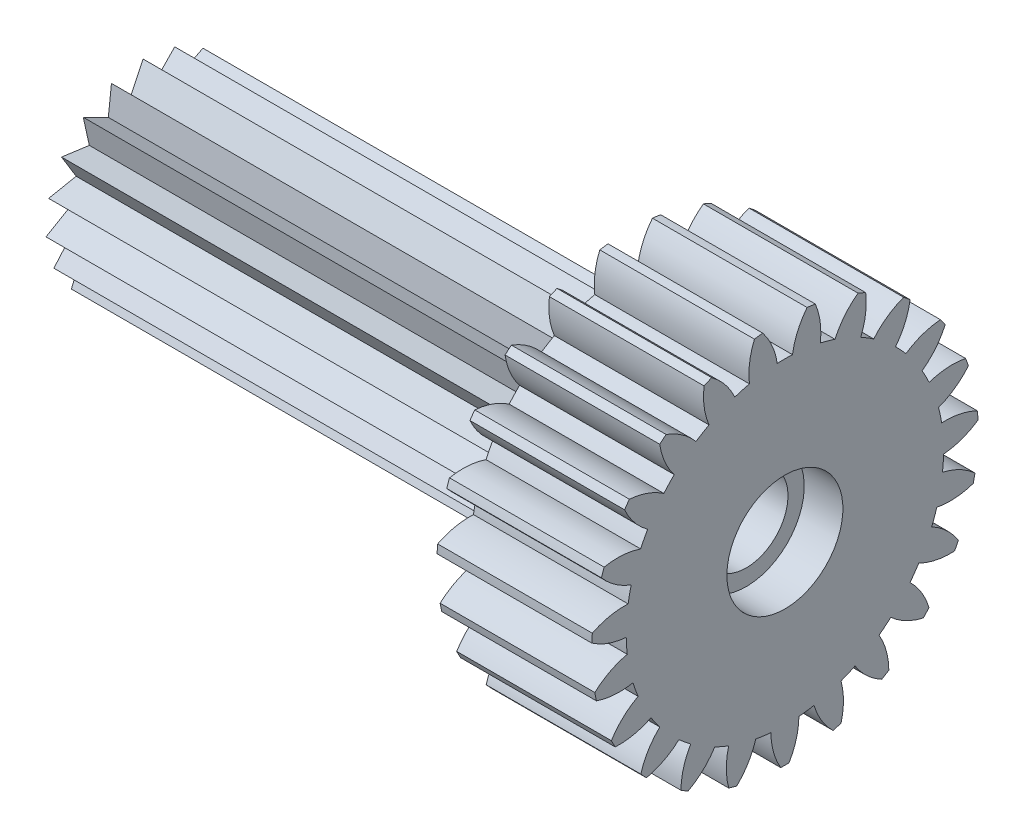
from build123d import *

# Parameters (mm, degrees)
BASPROSKE_W              = 12.7
BASPROSKE_H              = 15.875
TOOTHCUT_DEPTH           = 26.793821935
TEETHCUTS_COUNT          = 23
TEETHCUTS_ANGLE          = 344.347826087
BORSKE_R                 = 4.7625
BORE_DEPTH               = 50.8000508
BOSS_EXTRUDE1_DEPTH      = 40
BOSS_EXTRUDE1_DEPTH_BACK = 9.525
SKETCH2_R                = 3.429
CUT_EXTRUDE1_START       = -3.175
SKETCH3_R                = 4.7625
CUT_EXTRUDE1_DEPTH       = 3.175


with BuildPart() as part:
    # BasProSke → Base-Revolve (revolve)
    with BuildSketch(Plane(origin=(0, 0, 0), x_dir=(1, 0, 0), z_dir=(0, 1, 0)), mode=Mode.PRIVATE) as base_revolve_sk:
        with Locations((6.35, 7.9375)):
            Rectangle(BASPROSKE_W, BASPROSKE_H)
    revolve(base_revolve_sk.sketch.rotate(Axis((-10, 0, 0), (1, 0, 0)), 180), axis=Axis((-10, 0, 0), (1, 0, 0)))

    # TooCutSke → ToothCut (cut, through all)
    with BuildSketch(Plane(origin=(0, 0, 0), x_dir=(0, 0, -1), z_dir=(1, 0, 0))):
        with BuildLine():
            ThreePointArc((0.624636509, 13.015219601), (0, 13.0302), (-0.624636509, 13.015219601))
            ThreePointArc((-0.624636509, 13.015219601), (-1.049803144, 14.484664339), (-1.841853601, 15.793362387))
            ThreePointArc((-1.841853601, 15.793362387), (0, 15.9004), (1.841853601, 15.793362387))
            ThreePointArc((1.841853601, 15.793362387), (1.049803144, 14.484664339), (0.624636509, 13.015219601))
        make_face()
    toothcut = extrude(amount=TOOTHCUT_DEPTH, mode=Mode.SUBTRACT)

    # TeethCuts: ToothCut ×23 about axis
    teethcuts_axis = Axis((-10, 0, 0), (1, 0, 0))
    for i in range(1, TEETHCUTS_COUNT):
        add(toothcut.rotate(teethcuts_axis, i * TEETHCUTS_ANGLE / (TEETHCUTS_COUNT - 1)), mode=Mode.SUBTRACT)

    # BorSke → Bore (cut, symmetric)
    with BuildSketch(Plane(origin=(0, 0, 0), x_dir=(0, 0, -1), z_dir=(1, 0, 0))):
        with Locations(Location((0, 0, 0), (0, 0, 180))):
            Circle(BORSKE_R)
    extrude(amount=BORE_DEPTH, both=True, mode=Mode.SUBTRACT)

    # Sketch2 → Boss-Extrude1 (add, two sides: drawn at the far end of the back side and taken through both)
    with BuildSketch(Plane.ZY.offset(-BOSS_EXTRUDE1_DEPTH_BACK)):
        Polygon((2.597595754, 7.566537934), (2.855684358, 5.276842507), (4.913701702, 6.313124075), (4.414343464, 4.06368943), (6.697331826, 4.375585265), (5.49463996, 2.410172548), (7.755202128, 1.963883897), (5.979506958, 0.495476073), (7.972675944, -0.660634764), (5.816401596, -1.472912923), (7.326186613, -3.213563397), (5.02299887, -3.281688949), (5.885791285, -5.418252573), (3.685276276, -4.734843056), (3.807579144, -7.03579001), (1.948196815, -5.67490345), (1.316756722, -7.890890427), (0, -6), (-1.316756722, -7.890890427), (-1.948196815, -5.67490345), (-3.807579144, -7.03579001), (-3.685276276, -4.734843056), (-5.885791285, -5.418252573), (-5.02299887, -3.281688949), (-7.326186613, -3.213563397), (-5.816401596, -1.472912923), (-7.972675944, -0.660634764), (-5.979506958, 0.495476073), (-7.755202128, 1.963883897), (-5.49463996, 2.410172548), (-6.697331826, 4.375585265), (-4.414343464, 4.06368943), (-4.913701702, 6.313124075), (-2.855684358, 5.276842507), (-2.597595754, 7.566537934), (-0.987567542, 5.91816782), (0, 8), (0.987567542, 5.91816782), align=None)
        Circle(SKETCH2_R, mode=Mode.SUBTRACT)
    extrude(amount=BOSS_EXTRUDE1_DEPTH + BOSS_EXTRUDE1_DEPTH_BACK)

    # Sketch3 → Cut-Extrude1 (cut)
    with BuildSketch(Plane.ZY.offset(40).offset(CUT_EXTRUDE1_START)):
        Circle(SKETCH3_R)
    extrude(amount=CUT_EXTRUDE1_DEPTH, mode=Mode.SUBTRACT)


solid = part.part
